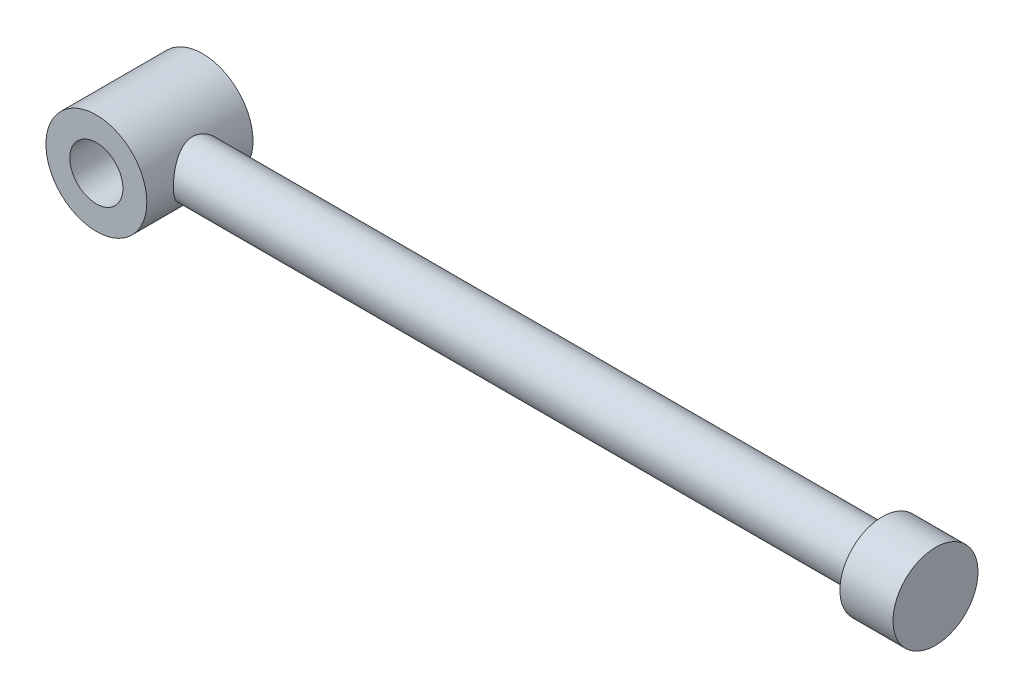
from build123d import *

# Parameters (mm, degrees)
SKETCH1_R                = 47.5
SKETCH1_R_2              = 25
BOSS_EXTRUDE1_DEPTH      = 100
BOSS_EXTRUDE2_REACH      = 797.244
BOSS_EXTRUDE2_END_RADIUS = 47.5
SKETCH2_R                = 25
SKETCH3_R                = 40
BOSS_EXTRUDE3_DEPTH      = 50


with BuildPart() as part:
    # Sketch1 → Boss-Extrude1 (new body)
    with BuildSketch(Plane.XY):
        Circle(SKETCH1_R)
        Circle(SKETCH1_R_2, mode=Mode.SUBTRACT)
    extrude(amount=BOSS_EXTRUDE1_DEPTH)

    # Boss-Extrude2: up to this cylinder (the profile starts outside it)
    boss_extrude2_end = Plane(origin=(0, 0, 50), z_dir=(0, 0, -1)) * Cylinder(BOSS_EXTRUDE2_END_RADIUS, 1690.488, mode=Mode.PRIVATE)
    # Sketch2 → Boss-Extrude2 (add, up to the surface)
    with BuildSketch(Plane(origin=(740, 0, 0), x_dir=(0, 0, -1), z_dir=(1, 0, 0)), mode=Mode.PRIVATE) as boss_extrude2_sk1:
        with Locations((-50, 0)):
            Circle(SKETCH2_R)
    boss_extrude2_tool1 = extrude(boss_extrude2_sk1.sketch, amount=-BOSS_EXTRUDE2_REACH, mode=Mode.PRIVATE) - boss_extrude2_end
    add(boss_extrude2_tool1.solids().sort_by_distance((740, 0, 50))[0])

    # Sketch3 → Boss-Extrude3 (add)
    with BuildSketch(Plane(origin=(740, 0, 0), x_dir=(0, 0, -1), z_dir=(1, 0, 0))):
        with Locations((-50, 0)):
            Circle(SKETCH3_R)
    extrude(amount=-BOSS_EXTRUDE3_DEPTH)


solid = part.part
